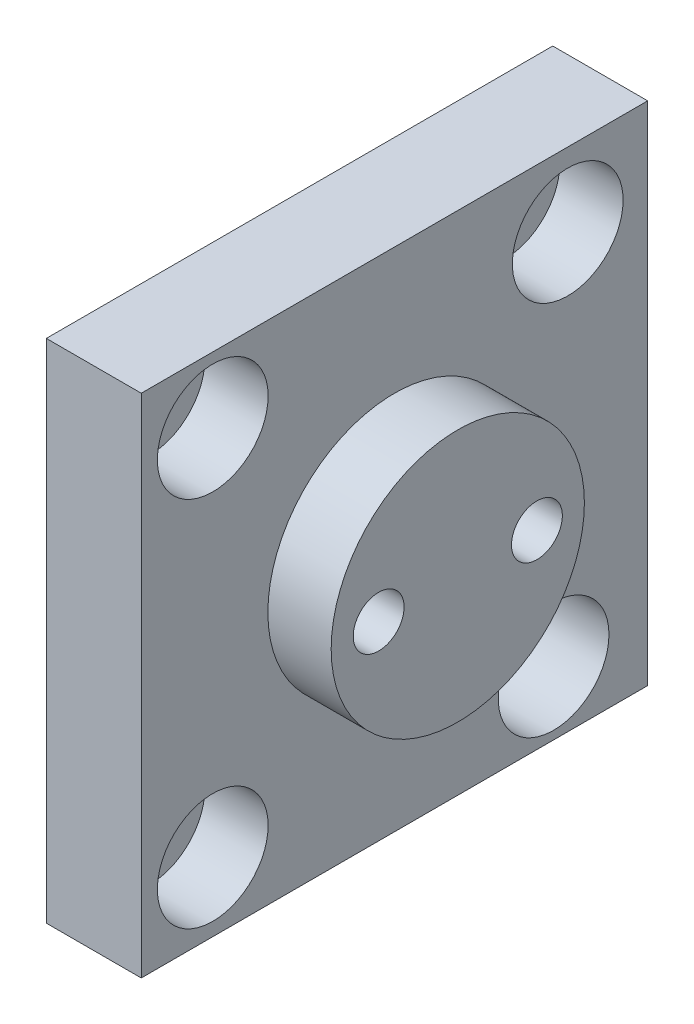
from build123d import *

# Parameters (mm, degrees)
SKETCH1_W                                        = 50.8
SKETCH1_H                                        = 50.8
BOSS_EXTRUDE1_DEPTH                              = 9.525
SKETCH2_R                                        = 12.7
BOSS_EXTRUDE2_DEPTH                              = 6.35
F_1_4_20_TAPPED_HOLE1_D                          = 5.1054
CBORE_FOR_1_4_SOCKET_HEAD_CAP_SCREW1_D           = 6.7564
CBORE_FOR_1_4_SOCKET_HEAD_CAP_SCREW1_CBORE_D     = 11.1125
CBORE_FOR_1_4_SOCKET_HEAD_CAP_SCREW1_CBORE_DEPTH = 6.35


with BuildPart() as part:
    # Sketch1 → Boss-Extrude1 (new body)
    with BuildSketch(Plane(origin=(0, 0, 0), x_dir=(0, 0, -1), z_dir=(1, 0, 0))):
        Rectangle(SKETCH1_W, SKETCH1_H)
    extrude(amount=BOSS_EXTRUDE1_DEPTH)

    # Sketch2 → Boss-Extrude2 (add)
    with BuildSketch(Plane(origin=(9.525, 0, 0), x_dir=(0, 0, -1), z_dir=(1, 0, 0))):
        Circle(SKETCH2_R)
    extrude(amount=BOSS_EXTRUDE2_DEPTH)

    # 1/4-20 Tapped Hole1 (through all)
    with Locations(Plane(origin=(15.875, 0, 0), x_dir=(0, 0, -1), z_dir=(1, 0, 0))):
        with Locations((-7.9375, 0), (7.9375, 0)):
            Hole(F_1_4_20_TAPPED_HOLE1_D / 2)

    # CBORE for 1/4 Socket Head Cap Screw1 (through all)
    with Locations(Plane(origin=(9.525, 0, 0), x_dir=(0, 0, -1), z_dir=(1, 0, 0))):
        with Locations((-18.22919312, 18.79663882), (17.378024569, 18.016400982), (15.959410319, -19.009430957), (-18.22919312, -18.51291597)):
            CounterBoreHole(CBORE_FOR_1_4_SOCKET_HEAD_CAP_SCREW1_D / 2, CBORE_FOR_1_4_SOCKET_HEAD_CAP_SCREW1_CBORE_D / 2, CBORE_FOR_1_4_SOCKET_HEAD_CAP_SCREW1_CBORE_DEPTH)


solid = part.part
